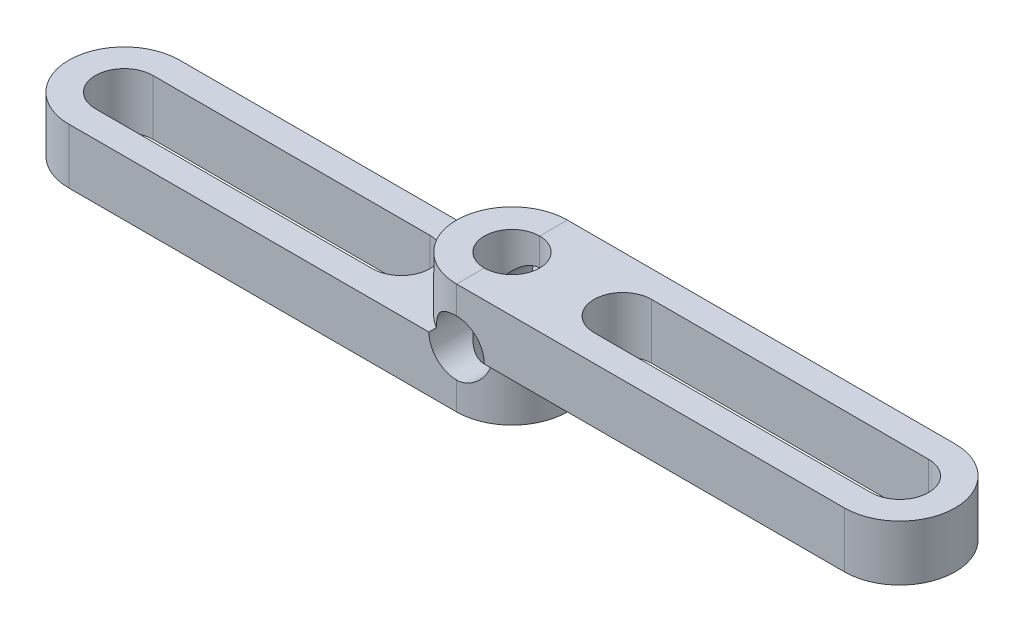
from build123d import *

# Parameters (mm, degrees)
BOSS_EXTRUDE1_DEPTH = 6.35
BOSS_EXTRUDE2_DEPTH = 6.35
BOSS_EXTRUDE3_DEPTH = 6.35
BOSS_EXTRUDE4_DEPTH = 6.35
CUT_EXTRUDE3_DEPTH  = 53.74706153
SKETCH9_R           = 3.175
CUT_EXTRUDE5_DEPTH  = 54.881536726
SKETCH10_R          = 3.175
CUT_EXTRUDE6_DEPTH  = 53.747061566


with BuildPart() as part:
    # Sketch1 → Boss-Extrude1 (new body)
    with BuildSketch(Plane(origin=(0, 0, 0), x_dir=(1, 0, 0), z_dir=(0, 1, 0))):
        with BuildLine():
            Line((0, 6.35), (-44.45, 6.35))
            ThreePointArc((-44.45, 6.35), (-50.8, 0), (-44.45, -6.35))
            Line((-44.45, -6.35), (0, -6.35))
            Line((0, -6.35), (0, 6.35))
        make_face()
    extrude(amount=BOSS_EXTRUDE1_DEPTH)

    # Sketch5 → Boss-Extrude3 (add)
    with BuildSketch(Plane(origin=(0, 6.35, 0), x_dir=(1, 0, 0), z_dir=(0, 1, 0))):
        with BuildLine():
            Line((0, 6.35), (0, -6.35))
            ThreePointArc((0, -6.35), (-6.35, 0), (0, 6.35))
        make_face()
    extrude(amount=BOSS_EXTRUDE3_DEPTH)

    # Sketch6 → Boss-Extrude4 (add)
    with BuildSketch(Plane.XZ):
        with BuildLine():
            Line((0, 6.35), (0, -6.35))
            ThreePointArc((0, -6.35), (6.35, 0), (0, 6.35))
        make_face()
    extrude(amount=-BOSS_EXTRUDE4_DEPTH)


with BuildPart() as body_2:
    # Sketch2 → Boss-Extrude2 (new body)
    with BuildSketch(Plane(origin=(0, 6.35, 0), x_dir=(1, 0, 0), z_dir=(0, 1, 0))):
        with BuildLine():
            Line((0, 6.35), (44.45, 6.35))
            ThreePointArc((44.45, 6.35), (50.8, 0), (44.45, -6.35))
            Line((44.45, -6.35), (0, -6.35))
            Line((0, -6.35), (0, 6.35))
        make_face()
    extrude(amount=BOSS_EXTRUDE2_DEPTH)


with BuildPart() as cut_extrude3_tool:
    # Sketch4 → Cut-Extrude3 (new, through all)
    with BuildSketch(Plane(origin=(0, 12.7, 0), x_dir=(1, 0, 0), z_dir=(0, 1, 0))):
        with BuildLine():
            Line((-44.45, 3.302), (-12.7, 3.302))
            ThreePointArc((-12.7, 3.302), (-9.398, 0), (-12.7, -3.302))
            Line((-12.7, -3.302), (-44.45, -3.302))
            ThreePointArc((-44.45, -3.302), (-47.752, 0), (-44.45, 3.302))
        make_face()
        with BuildLine():
            Line((44.45, -3.302), (12.7, -3.302))
            ThreePointArc((12.7, -3.302), (9.398, 0), (12.7, 3.302))
            Line((12.7, 3.302), (44.45, 3.302))
            ThreePointArc((44.45, 3.302), (47.752, 0), (44.45, -3.302))
        make_face()
    extrude(amount=-CUT_EXTRUDE3_DEPTH)


with BuildPart() as part_1:
    add(part.part)

    # Cut-Extrude3: cut by cut_extrude3_tool
    add(cut_extrude3_tool.part, mode=Mode.SUBTRACT)


with BuildPart() as body_2_1:
    add(body_2.part)

    # Cut-Extrude3: cut by cut_extrude3_tool
    add(cut_extrude3_tool.part, mode=Mode.SUBTRACT)


with BuildPart() as cut_extrude5_tool:
    # Sketch9 → Cut-Extrude5 (new, through all)
    with BuildSketch(Plane.XY.offset(6.35)):
        with Locations((0, 6.35)):
            Circle(SKETCH9_R)
    extrude(amount=-CUT_EXTRUDE5_DEPTH)


with BuildPart() as part_2:
    add(part_1.part)

    # Cut-Extrude5: cut by cut_extrude5_tool
    add(cut_extrude5_tool.part, mode=Mode.SUBTRACT)


with BuildPart() as body_2_2:
    add(body_2_1.part)

    # Cut-Extrude5: cut by cut_extrude5_tool
    add(cut_extrude5_tool.part, mode=Mode.SUBTRACT)


with BuildPart() as cut_extrude6_tool:
    # Sketch10 → Cut-Extrude6 (new, through all)
    with BuildSketch(Plane(origin=(0, 12.7, 0), x_dir=(1, 0, 0), z_dir=(0, 1, 0))):
        with Locations(Location((0, 0, 0), (0, 0, 270))):
            Circle(SKETCH10_R)
    extrude(amount=-CUT_EXTRUDE6_DEPTH)


with BuildPart() as part_3:
    add(part_2.part)

    # Cut-Extrude6: cut by cut_extrude6_tool
    add(cut_extrude6_tool.part, mode=Mode.SUBTRACT)


with BuildPart() as body_2_3:
    add(body_2_2.part)

    # Cut-Extrude6: cut by cut_extrude6_tool
    add(cut_extrude6_tool.part, mode=Mode.SUBTRACT)


solid = Compound([part_3.part, body_2_3.part])
